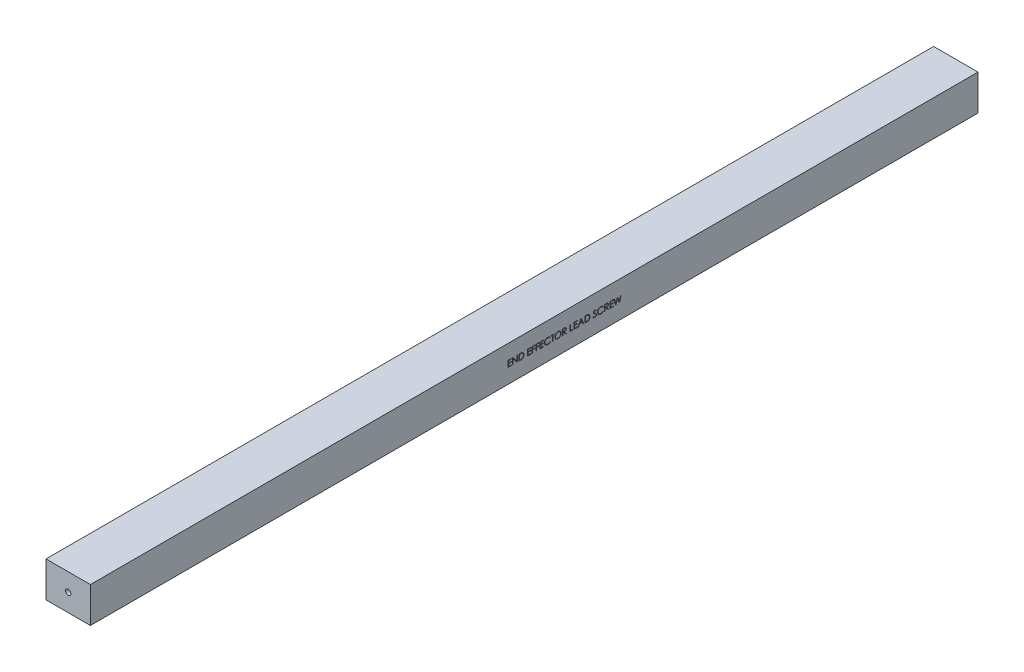
from build123d import *

# Parameters (mm, degrees)
SKETCH1_W           = 25.4
SKETCH1_H           = 20.32
BOSS_EXTRUDE1_DEPTH = 508
CUT_EXTRUDE1_DEPTH  = 2
SKETCH3_R           = 1.5
CUT_EXTRUDE2_DEPTH  = 12.7


with BuildPart() as part:
    # Sketch1 → Boss-Extrude1 (new body)
    with BuildSketch(Plane.XY):
        Rectangle(SKETCH1_W, SKETCH1_H)
    extrude(amount=BOSS_EXTRUDE1_DEPTH)

    # Sketch2 → Cut-Extrude1 (cut)
    # profile 1 of 20: a face of its own
    with BuildSketch(Plane(origin=(12.7, 0, 0), x_dir=(0, 0, -1), z_dir=(1, 0, 0))):
        Polygon((-268.940166523, 1.755607932), (-266.965807548, 1.755607932), (-266.965807548, 1.396633573), (-268.626063959, 1.396633573), (-268.626063959, 0.319710496), (-266.965807548, 0.319710496), (-266.965807548, -0.039263863), (-268.626063959, -0.039263863), (-268.626063959, -1.385417709), (-266.965807548, -1.385417709), (-266.965807548, -1.744392068), (-268.940166523, -1.744392068), align=None)
    # profile 2 of 20: a face of its own
    with BuildSketch(Plane(origin=(12.7, 0, 0), x_dir=(0, 0, -1), z_dir=(1, 0, 0))):
        Polygon((-266.33760242, -1.744392068), (-266.33760242, 1.755607932), (-266.271696971, 1.755607932), (-263.959397292, -0.9990996), (-263.959397292, 1.755607932), (-263.645294728, 1.755607932), (-263.645294728, -1.744392068), (-263.716809151, -1.744392068), (-266.023499856, 1.004005368), (-266.023499856, -1.744392068), align=None)
    # profile 3 of 20: a face of its own
    with BuildSketch(Plane(origin=(12.7, 0, 0), x_dir=(0, 0, -1), z_dir=(1, 0, 0))):
        with BuildLine():
            Line((-262.74785883, -1.744392068), (-262.74785883, 1.755607932))
            Line((-262.74785883, 1.755607932), (-262.041128061, 1.755607932))
            add(Edge.make_bspline(
                [(-262.041128061, 1.755607932), (-261.979659073, 1.755165362), (-261.860901308, 1.754310319), (-261.68928886, 1.748888928), (-261.530505098, 1.739298462), (-261.385072239, 1.725328936), (-261.252591027, 1.708175902), (-261.133432418, 1.686675498), (-261.026980276, 1.661287328), (-260.961510835, 1.639641877), (-260.930551138, 1.629406009)],
                knots=[0, 0, 0, 0, 1.314313732, 2.53924729, 3.670748893, 4.714932338, 5.66265055, 6.526160246, 7.303039223, 8, 8, 8, 8], degree=3))
            add(Edge.make_bspline(
                [(-260.930551138, 1.629406009), (-260.890056399, 1.613975303), (-260.809985206, 1.583463809), (-260.695978084, 1.525907508), (-260.588652721, 1.460694406), (-260.487433576, 1.387738543), (-260.39463275, 1.304974195), (-260.306624853, 1.215917109), (-260.227010129, 1.117328769), (-260.154101833, 1.011253781), (-260.088366174, 0.898941729), (-260.031227016, 0.78060662), (-259.983773022, 0.656849412), (-259.944379796, 0.528014264), (-259.913333338, 0.393817886), (-259.892151407, 0.25410402), (-259.878180417, 0.109424831), (-259.876776365, 0.011250367), (-259.876063959, -0.038562741)],
                knots=[0, 0, 0, 0, 0.984719456, 1.947108742, 2.898477687, 3.838006223, 4.779231079, 5.722358779, 6.681677486, 7.655904652, 8.64651281, 9.637519902, 10.640069247, 11.656948941, 12.698408672, 13.768548281, 14.867775369, 16, 16, 16, 16], degree=3))
            add(Edge.make_bspline(
                [(-259.876063959, -0.038562741), (-259.876692926, -0.081823979), (-259.877932372, -0.167074768), (-259.889061688, -0.292715664), (-259.905238008, -0.414629235), (-259.930282206, -0.532234935), (-259.960684719, -0.646563153), (-259.999648871, -0.756395398), (-260.044284367, -0.862739207), (-260.096334245, -0.964156683), (-260.15347563, -1.060240055), (-260.214797374, -1.150815583), (-260.280234069, -1.234590805), (-260.350409702, -1.311819417), (-260.424417418, -1.382384996), (-260.502741749, -1.446877011), (-260.5855848, -1.504033566), (-260.672575522, -1.556100674), (-260.766251652, -1.60152103), (-260.868387518, -1.639951039), (-260.979418696, -1.671797655), (-261.099072653, -1.698368551), (-261.22755613, -1.719445853), (-261.364995096, -1.733572246), (-261.511178386, -1.743125178), (-261.611557651, -1.743961572), (-261.663223414, -1.744392068)],
                knots=[0, 0, 0, 0, 1.105936401, 2.179363191, 3.223086493, 4.248585256, 5.251745608, 6.245858792, 7.225916811, 8.198733463, 9.158002045, 10.082870192, 10.993790845, 11.873723703, 12.748670949, 13.606408763, 14.465103618, 15.319838547, 16.196477973, 17.123216899, 18.106603292, 19.147568657, 20.255746949, 21.433717677, 22.679120308, 24, 24, 24, 24], degree=3))
            Line((-261.663223414, -1.744392068), (-262.74785883, -1.744392068))
        make_face()
        with BuildLine():
            Line((-262.433756266, -1.385417709), (-262.032013478, -1.385417709))
            add(Edge.make_bspline(
                [(-262.032013478, -1.385417709), (-261.974285107, -1.385169613), (-261.863252309, -1.384692432), (-261.703594311, -1.380505229), (-261.557714915, -1.373663292), (-261.425593405, -1.364088214), (-261.307304381, -1.351419599), (-261.202600631, -1.337294696), (-261.111825373, -1.319697245), (-261.056895936, -1.303746286), (-261.031512676, -1.296375241)],
                knots=[0, 0, 0, 0, 1.375205317, 2.645023457, 3.804390687, 4.853969522, 5.800190428, 6.637939096, 7.370582563, 8, 8, 8, 8], degree=3))
            add(Edge.make_bspline(
                [(-261.031512676, -1.296375241), (-260.999564314, -1.285123683), (-260.936430676, -1.26288931), (-260.845549591, -1.222331648), (-260.760792586, -1.174289579), (-260.680682561, -1.120887305), (-260.606355906, -1.060241303), (-260.536931789, -0.993670314), (-260.472549988, -0.920835539), (-260.41387568, -0.841827377), (-260.361367376, -0.757137581), (-260.315896147, -0.667598748), (-260.276044615, -0.574191938), (-260.244766022, -0.475482779), (-260.220250438, -0.372353721), (-260.20288575, -0.264797507), (-260.192071026, -0.152834225), (-260.190809578, -0.076682101), (-260.190166523, -0.037861619)],
                knots=[0, 0, 0, 0, 0.998632004, 1.973411704, 2.929992603, 3.868527914, 4.809262121, 5.754881198, 6.702106254, 7.672490631, 8.653608572, 9.636854334, 10.631411391, 11.644891563, 12.686317036, 13.754757253, 14.855430412, 16, 16, 16, 16], degree=3))
            add(Edge.make_bspline(
                [(-260.190166523, -0.037861619), (-260.19067981, 0.003071861), (-260.191688168, 0.083486045), (-260.204362478, 0.201476741), (-260.222884034, 0.314957391), (-260.24966772, 0.423935587), (-260.283798598, 0.528623939), (-260.32639324, 0.628443449), (-260.375059859, 0.724448318), (-260.432963196, 0.814422684), (-260.49637879, 0.899515793), (-260.566756669, 0.977470708), (-260.642978707, 1.048465009), (-260.724213557, 1.113604321), (-260.812750656, 1.170267997), (-260.906504347, 1.220954678), (-261.006850018, 1.26397057), (-261.076662714, 1.286849432), (-261.112141683, 1.298476522)],
                knots=[0, 0, 0, 0, 1.122418816, 2.205001699, 3.251619955, 4.274784885, 5.280384055, 6.268708349, 7.249350384, 8.229342522, 9.199999885, 10.157847722, 11.105861043, 12.055065948, 13.010012805, 13.98527497, 14.976112212, 16, 16, 16, 16], degree=3))
            add(Edge.make_bspline(
                [(-261.112141683, 1.298476522), (-261.141492829, 1.30659295), (-261.20390142, 1.323850702), (-261.305740884, 1.342676075), (-261.420356033, 1.359280574), (-261.548255734, 1.373338613), (-261.689294193, 1.383425934), (-261.843579881, 1.390997249), (-262.011179486, 1.396103882), (-262.12736202, 1.396452589), (-262.187662516, 1.396633573)],
                knots=[0, 0, 0, 0, 0.674548936, 1.434276114, 2.292660221, 3.240891867, 4.284742987, 5.42552168, 6.663806718, 8, 8, 8, 8], degree=3))
            Line((-262.187662516, 1.396633573), (-262.433756266, 1.396633573))
            Line((-262.433756266, 1.396633573), (-262.433756266, -1.385417709))
        make_face(mode=Mode.SUBTRACT)
    # profile 4 of 20: a face of its own
    with BuildSketch(Plane(origin=(12.7, 0, 0), x_dir=(0, 0, -1), z_dir=(1, 0, 0))):
        Polygon((-257.811961394, 1.755607932), (-255.83760242, 1.755607932), (-255.83760242, 1.396633573), (-257.49785883, 1.396633573), (-257.49785883, 0.319710496), (-255.83760242, 0.319710496), (-255.83760242, -0.039263863), (-257.49785883, -0.039263863), (-257.49785883, -1.385417709), (-255.83760242, -1.385417709), (-255.83760242, -1.744392068), (-257.811961394, -1.744392068), align=None)
    # profile 5 of 20: a face of its own
    with BuildSketch(Plane(origin=(12.7, 0, 0), x_dir=(0, 0, -1), z_dir=(1, 0, 0))):
        Polygon((-255.209397292, 1.755607932), (-253.504269087, 1.755607932), (-253.504269087, 1.396633573), (-254.895294728, 1.396633573), (-254.895294728, 0.319710496), (-253.504269087, 0.319710496), (-253.504269087, -0.039263863), (-254.895294728, -0.039263863), (-254.895294728, -1.744392068), (-255.209397292, -1.744392068), align=None)
    # profile 6 of 20: a face of its own
    with BuildSketch(Plane(origin=(12.7, 0, 0), x_dir=(0, 0, -1), z_dir=(1, 0, 0))):
        Polygon((-252.876063959, 1.755607932), (-251.170935753, 1.755607932), (-251.170935753, 1.396633573), (-252.561961394, 1.396633573), (-252.561961394, 0.319710496), (-251.170935753, 0.319710496), (-251.170935753, -0.039263863), (-252.561961394, -0.039263863), (-252.561961394, -1.744392068), (-252.876063959, -1.744392068), align=None)
    # profile 7 of 20: a face of its own
    with BuildSketch(Plane(origin=(12.7, 0, 0), x_dir=(0, 0, -1), z_dir=(1, 0, 0))):
        Polygon((-250.542730625, 1.755607932), (-248.568371651, 1.755607932), (-248.568371651, 1.396633573), (-250.228628061, 1.396633573), (-250.228628061, 0.319710496), (-248.568371651, 0.319710496), (-248.568371651, -0.039263863), (-250.228628061, -0.039263863), (-250.228628061, -1.385417709), (-248.568371651, -1.385417709), (-248.568371651, -1.744392068), (-250.542730625, -1.744392068), align=None)
    # profile 8 of 20: a face of its own
    with BuildSketch(Plane(origin=(12.7, 0, 0), x_dir=(0, 0, -1), z_dir=(1, 0, 0))):
        with BuildLine():
            Line((-244.709397292, 1.113380368), (-244.984237035, 0.90304383))
            add(Edge.make_bspline(
                [(-244.984237035, 0.90304383), (-245.003842924, 0.926409799), (-245.042790371, 0.972826715), (-245.105449573, 1.03800626), (-245.170751216, 1.099071521), (-245.238670337, 1.156313401), (-245.310429457, 1.207730166), (-245.384290255, 1.256001269), (-245.461488301, 1.299269007), (-245.568240035, 1.351731993), (-245.707887884, 1.406478148), (-245.883682723, 1.45238138), (-246.067193821, 1.481602555), (-246.192391421, 1.484767397), (-246.256071971, 1.486377163)],
                knots=[0, 0, 0, 0, 0.757959112, 1.505699292, 2.245454638, 2.979532153, 3.711538275, 4.438200793, 5.171680507, 5.909471876, 7.393775596, 8.890124382, 10.418191784, 12, 12, 12, 12], degree=3))
            add(Edge.make_bspline(
                [(-246.256071971, 1.486377163), (-246.291155271, 1.4859732), (-246.360996263, 1.485169024), (-246.464644737, 1.474559899), (-246.566357788, 1.459648689), (-246.666069254, 1.437523366), (-246.763652213, 1.409550747), (-246.859744615, 1.376125333), (-246.952955215, 1.334770493), (-247.044573453, 1.289062233), (-247.132352664, 1.237434788), (-247.215407712, 1.181121437), (-247.293435679, 1.12075234), (-247.366498292, 1.056101234), (-247.43467024, 0.987459273), (-247.497457551, 0.914094932), (-247.554642961, 0.836242758), (-247.607359986, 0.754929351), (-247.654572719, 0.670391559), (-247.694102599, 0.582316489), (-247.729107721, 0.492212385), (-247.756806964, 0.399061225), (-247.77873148, 0.303518459), (-247.793859144, 0.205327671), (-247.804347615, 0.104693991), (-247.805147792, 0.036484679), (-247.805551138, 0.002102323)],
                knots=[0, 0, 0, 0, 1.054917814, 2.100044995, 3.131103042, 4.146048494, 5.169673617, 6.183595914, 7.203665975, 8.234915748, 9.262203917, 10.264457458, 11.251630812, 12.227803204, 13.197192746, 14.159520551, 15.12972552, 16.100847026, 17.073214652, 18.039054194, 19.002613845, 19.979014051, 20.95965708, 21.949030935, 22.966165397, 24, 24, 24, 24], degree=3))
            add(Edge.make_bspline(
                [(-247.805551138, 0.002102323), (-247.804289319, -0.049628997), (-247.801811905, -0.151196582), (-247.779763571, -0.299967192), (-247.746258479, -0.442487866), (-247.696042902, -0.577867708), (-247.634123852, -0.707776066), (-247.55588324, -0.83001492), (-247.465266703, -0.946431484), (-247.360992284, -1.054274432), (-247.246586468, -1.152788157), (-247.123838556, -1.239538739), (-246.993054268, -1.311853621), (-246.855677638, -1.372029568), (-246.710651524, -1.418286295), (-246.558236722, -1.450850419), (-246.398764726, -1.4720926), (-246.289795327, -1.474126288), (-246.234337196, -1.475161299)],
                knots=[0, 0, 0, 0, 1.029171465, 2.020641659, 2.987623507, 3.938342917, 4.889210282, 5.84687017, 6.821220943, 7.821438502, 8.827599549, 9.822697543, 10.807740252, 11.797342354, 12.80366471, 13.83203677, 14.896651826, 16, 16, 16, 16], degree=3))
            add(Edge.make_bspline(
                [(-246.234337196, -1.475161299), (-246.173234507, -1.473472519), (-246.052969798, -1.470148596), (-245.876601771, -1.441989347), (-245.707766006, -1.396331429), (-245.546453419, -1.332433507), (-245.393118773, -1.249368219), (-245.247522113, -1.148670342), (-245.109540542, -1.029382009), (-245.02656926, -0.938298881), (-244.984237035, -0.891827965)],
                knots=[0, 0, 0, 0, 1.028121516, 2.023589091, 2.998037872, 3.967518031, 4.937445131, 5.927275754, 6.942489185, 8, 8, 8, 8], degree=3))
            Line((-244.984237035, -0.891827965), (-244.709397292, -1.100061138))
            add(Edge.make_bspline(
                [(-244.709397292, -1.100061138), (-244.731515402, -1.12859959), (-244.775645677, -1.185539797), (-244.847103694, -1.265811506), (-244.922380991, -1.341315542), (-245.002036701, -1.411443163), (-245.085154493, -1.477597629), (-245.173226805, -1.53789946), (-245.265095838, -1.593190344), (-245.360450317, -1.643817269), (-245.45918893, -1.688734516), (-245.561193365, -1.727188284), (-245.66602394, -1.760313173), (-245.773685448, -1.78756511), (-245.884401205, -1.808836194), (-245.997771679, -1.823055869), (-246.114041555, -1.832797783), (-246.192482976, -1.833685699), (-246.23223383, -1.834135658)],
                knots=[0, 0, 0, 0, 0.986787822, 1.968848986, 2.935600012, 3.899624008, 4.868462664, 5.837806735, 6.815139263, 7.798259679, 8.787526145, 9.778297419, 10.776456485, 11.791383307, 12.812564526, 13.85620153, 14.913611965, 16, 16, 16, 16], degree=3))
            add(Edge.make_bspline(
                [(-246.23223383, -1.834135658), (-246.269877497, -1.833873665), (-246.344313188, -1.833355607), (-246.454211939, -1.82496344), (-246.56120152, -1.813513703), (-246.664976146, -1.796273572), (-246.766102121, -1.775929232), (-246.863662705, -1.748657975), (-246.958617916, -1.718108809), (-247.050586256, -1.682203822), (-247.139645956, -1.641687639), (-247.225509768, -1.59589608), (-247.3081382, -1.545214216), (-247.388343621, -1.490759205), (-247.464941204, -1.430781903), (-247.53859473, -1.366115269), (-247.609717206, -1.296977258), (-247.653719891, -1.247122405), (-247.675843606, -1.222056331)],
                knots=[0, 0, 0, 0, 1.114604814, 2.203992996, 3.262667896, 4.300477797, 5.318619304, 6.316056647, 7.298880507, 8.271930387, 9.238335007, 10.195173496, 11.151986948, 12.108099108, 13.064862484, 14.031167946, 15.010108607, 16, 16, 16, 16], degree=3))
            add(Edge.make_bspline(
                [(-247.675843606, -1.222056331), (-247.711279249, -1.178515142), (-247.781722726, -1.091958431), (-247.87184841, -0.95167245), (-247.948995965, -0.805204241), (-248.011371886, -0.651784313), (-248.060134619, -0.491756925), (-248.093915814, -0.325041411), (-248.115867419, -0.151793469), (-248.118377707, -0.03395668), (-248.119653702, 0.025940464)],
                knots=[0, 0, 0, 0, 0.994628077, 1.977248131, 2.950237994, 3.925870899, 4.908910175, 5.911660606, 6.938484602, 8, 8, 8, 8], degree=3))
            add(Edge.make_bspline(
                [(-248.119653702, 0.025940464), (-248.118098509, 0.088895918), (-248.115038762, 0.212756842), (-248.089042967, 0.394530796), (-248.047224171, 0.568682194), (-247.987827282, 0.734885939), (-247.912521931, 0.894016219), (-247.819495317, 1.044857424), (-247.709828175, 1.188374224), (-247.584380607, 1.322388975), (-247.446813272, 1.444928328), (-247.299494458, 1.552734531), (-247.142712511, 1.642452047), (-246.978194659, 1.71744821), (-246.804708978, 1.775092673), (-246.622625609, 1.81544586), (-246.432286694, 1.840562976), (-246.302424268, 1.843738184), (-246.236440561, 1.845351522)],
                knots=[0, 0, 0, 0, 1.032925535, 2.032216505, 3.007276963, 3.968222605, 4.92396291, 5.891752235, 6.871517503, 7.883894988, 8.900124299, 9.891468569, 10.874487609, 11.85992873, 12.854644235, 13.869047385, 14.917252991, 16, 16, 16, 16], degree=3))
            add(Edge.make_bspline(
                [(-246.236440561, 1.845351522), (-246.196226089, 1.844869384), (-246.116625592, 1.84391504), (-245.998872939, 1.834608898), (-245.884230613, 1.819095291), (-245.77261963, 1.797979221), (-245.663497014, 1.7717719), (-245.557696773, 1.737631602), (-245.454598087, 1.69859507), (-245.354851178, 1.653636604), (-245.258934628, 1.603169863), (-245.16687831, 1.547754239), (-245.079413451, 1.487458434), (-244.995924603, 1.422795259), (-244.917808391, 1.352396699), (-244.842846913, 1.278199103), (-244.773585835, 1.198065279), (-244.73083264, 1.141660345), (-244.709397292, 1.113380368)],
                knots=[0, 0, 0, 0, 1.096760587, 2.17092713, 3.219439832, 4.250915756, 5.268269357, 6.278326846, 7.281116186, 8.274029601, 9.260640565, 10.235837813, 11.203064059, 12.156899882, 13.114053108, 14.069676657, 15.032185724, 16, 16, 16, 16], degree=3))
        make_face()
    # profile 9 of 20: a face of its own
    with BuildSketch(Plane(origin=(12.7, 0, 0), x_dir=(0, 0, -1), z_dir=(1, 0, 0))):
        Polygon((-244.395294728, 1.396633573), (-244.395294728, 1.755607932), (-242.555551138, 1.755607932), (-242.555551138, 1.396633573), (-243.318371651, 1.396633573), (-243.318371651, -1.744392068), (-243.632474215, -1.744392068), (-243.632474215, 1.396633573), align=None)
    # profile 10 of 20: a face of its own
    with BuildSketch(Plane(origin=(12.7, 0, 0), x_dir=(0, 0, -1), z_dir=(1, 0, 0))):
        with BuildLine():
            add(Edge.make_bspline(
                [(-240.379269087, 1.845351522), (-240.314460981, 1.843710042), (-240.187172514, 1.840486042), (-240.000097616, 1.815806938), (-239.821502521, 1.773111548), (-239.649932382, 1.716248566), (-239.487439406, 1.64039418), (-239.332800513, 1.548709032), (-239.186383639, 1.440232573), (-239.050162258, 1.315803346), (-238.925505307, 1.180419892), (-238.815679421, 1.035941982), (-238.723637127, 0.88324318), (-238.64805134, 0.722782349), (-238.588752731, 0.554922381), (-238.547833687, 0.378768379), (-238.521695537, 0.195461688), (-238.518639759, 0.070434824), (-238.5170896, 0.007010176)],
                knots=[0, 0, 0, 0, 1.065120563, 2.091984664, 3.0946048, 4.079830382, 5.057816894, 6.036188127, 7.030412546, 8.04752943, 9.064399622, 10.05169764, 11.02544977, 11.989514704, 12.962713494, 13.945757189, 14.957906945, 16, 16, 16, 16], degree=3))
            add(Edge.make_bspline(
                [(-238.5170896, 0.007010176), (-238.518639532, -0.055947271), (-238.521694629, -0.180043691), (-238.547863406, -0.362187135), (-238.588904406, -0.537277832), (-238.647500672, -0.705023485), (-238.722726151, -0.865601048), (-238.815381322, -1.018588002), (-238.924522533, -1.164034501), (-239.048729384, -1.300347166), (-239.184130426, -1.425344637), (-239.329360693, -1.534263512), (-239.481154012, -1.627987637), (-239.641463721, -1.702771311), (-239.808163757, -1.762543231), (-239.982746081, -1.803295861), (-240.164392635, -1.829582904), (-240.288263638, -1.83260142), (-240.351224215, -1.834135658)],
                knots=[0, 0, 0, 0, 1.043624062, 2.057103931, 3.04512605, 4.022047818, 4.998200453, 5.980619268, 6.982898556, 8.009068085, 9.034988726, 10.034168286, 11.015286542, 11.987931943, 12.962482838, 13.94673481, 14.956375938, 16, 16, 16, 16], degree=3))
            add(Edge.make_bspline(
                [(-240.351224215, -1.834135658), (-240.414648534, -1.832586271), (-240.53967475, -1.829532017), (-240.723211785, -1.803350612), (-240.899489529, -1.762409308), (-241.06800388, -1.703899872), (-241.22884881, -1.628282641), (-241.382338893, -1.536078262), (-241.52785804, -1.426671121), (-241.664199786, -1.302504547), (-241.788948985, -1.167332994), (-241.89770836, -1.022498739), (-241.989933474, -0.870843283), (-242.065296806, -0.711945759), (-242.124961265, -0.546574316), (-242.165666084, -0.373625838), (-242.192002036, -0.194086333), (-242.195036882, -0.071843434), (-242.196576779, -0.009816747)],
                knots=[0, 0, 0, 0, 1.053102029, 2.075944431, 3.073151272, 4.055350789, 5.033113405, 6.020478099, 7.024410459, 8.052272461, 9.079885166, 10.07527673, 11.055994387, 12.023226415, 12.992069828, 13.970394897, 14.97016774, 16, 16, 16, 16], degree=3))
            add(Edge.make_bspline(
                [(-242.196576779, -0.009816747), (-242.196042144, 0.031815922), (-242.194979617, 0.114556045), (-242.182187925, 0.237422645), (-242.163626224, 0.358313303), (-242.137024311, 0.476884251), (-242.102232644, 0.592845236), (-242.061180617, 0.706995999), (-242.011040771, 0.818179722), (-241.954360123, 0.926923114), (-241.891098315, 1.03153102), (-241.821222566, 1.130410603), (-241.747187197, 1.2243916), (-241.666023804, 1.311038604), (-241.580407358, 1.39287226), (-241.48894898, 1.468634977), (-241.392206736, 1.539009928), (-241.289764356, 1.602430269), (-241.184146081, 1.659789404), (-241.075269304, 1.709011255), (-240.964612732, 1.751257316), (-240.851658084, 1.785498141), (-240.736705312, 1.812530177), (-240.619503527, 1.830937531), (-240.500146101, 1.843761849), (-240.419734782, 1.844819351), (-240.379269087, 1.845351522)],
                knots=[0, 0, 0, 0, 1.037015668, 2.060948919, 3.074880161, 4.083647147, 5.086022904, 6.090072063, 7.104153813, 8.122640571, 9.144368836, 10.147691507, 11.138137339, 12.123020368, 13.103399296, 14.087645067, 15.080126199, 16.082011238, 17.087798457, 18.072939717, 19.057185487, 20.037253025, 21.01195951, 21.997135196, 22.992090687, 24, 24, 24, 24], degree=3))
        make_face()
        with BuildLine():
            add(Edge.make_bspline(
                [(-240.363844407, 1.486377163), (-240.397059041, 1.485972273), (-240.463170774, 1.485166363), (-240.56145531, 1.474550647), (-240.658447244, 1.459420758), (-240.754166606, 1.437839238), (-240.848212895, 1.408435185), (-240.941462737, 1.374594277), (-241.03306579, 1.333373186), (-241.122719648, 1.286800482), (-241.209634723, 1.235251561), (-241.291647425, 1.178279794), (-241.368970069, 1.11722124), (-241.441413335, 1.051933402), (-241.508764508, 0.9820838), (-241.572349209, 0.908731364), (-241.629618791, 0.829779473), (-241.682104368, 0.747369066), (-241.729072208, 0.661607485), (-241.770837563, 0.573397623), (-241.805001571, 0.482019936), (-241.832863948, 0.388465779), (-241.855963759, 0.292883319), (-241.870597683, 0.19454747), (-241.881330042, 0.093952358), (-241.882089888, 0.025970504), (-241.882474215, -0.008414504)],
                knots=[0, 0, 0, 0, 1.008559885, 2.007477868, 2.99961109, 3.989939068, 4.984837346, 5.991145699, 7.001802488, 8.033829008, 9.059044045, 10.069351652, 11.065060232, 12.050310815, 13.029377138, 14.011219647, 14.996725999, 15.989392538, 16.977580475, 17.965360261, 18.951710183, 19.937753436, 20.929683414, 21.935841486, 22.955955122, 24, 24, 24, 24], degree=3))
            add(Edge.make_bspline(
                [(-241.882474215, -0.008414504), (-241.881199353, -0.058976725), (-241.878691305, -0.158448255), (-241.856733735, -0.304216399), (-241.822911761, -0.444304685), (-241.773054394, -0.577946594), (-241.710703779, -0.706290877), (-241.633676889, -0.828198982), (-241.542417804, -0.943703856), (-241.438754277, -1.051999125), (-241.32543157, -1.150844929), (-241.205098841, -1.237608338), (-241.079045233, -1.311018588), (-240.94694203, -1.37082366), (-240.809494491, -1.418213398), (-240.66581694, -1.450692029), (-240.516866481, -1.472067485), (-240.415335825, -1.474120241), (-240.363844407, -1.475161299)],
                knots=[0, 0, 0, 0, 1.032063989, 2.030389145, 3.003944642, 3.970395727, 4.937377036, 5.913328081, 6.909231446, 7.93887556, 8.970685674, 9.976071282, 10.964166581, 11.944589148, 12.933237628, 13.927779006, 14.949070134, 16, 16, 16, 16], degree=3))
            add(Edge.make_bspline(
                [(-240.363844407, -1.475161299), (-240.329234906, -1.474685794), (-240.260593869, -1.473742726), (-240.158498347, -1.46424405), (-240.058242135, -1.44901218), (-239.959965855, -1.427081524), (-239.863781044, -1.399634318), (-239.769286241, -1.36702659), (-239.67748795, -1.326345386), (-239.587228113, -1.281397435), (-239.500831871, -1.230157277), (-239.418356339, -1.175119128), (-239.341880359, -1.114150507), (-239.269491287, -1.049832694), (-239.201863598, -0.980868847), (-239.139454614, -0.907348625), (-239.082474482, -0.828807967), (-239.030008835, -0.746522562), (-238.983205573, -0.660526309), (-238.942426474, -0.571996631), (-238.907830358, -0.481151522), (-238.879901853, -0.38785995), (-238.858016391, -0.292299101), (-238.842936471, -0.194341023), (-238.832388033, -0.094181681), (-238.831592956, -0.026437825), (-238.831192164, 0.007711297)],
                knots=[0, 0, 0, 0, 1.047197238, 2.076906641, 3.100256066, 4.114471768, 5.12198147, 6.126382909, 7.136867548, 8.15857795, 9.17633901, 10.174870724, 11.156907918, 12.133735059, 13.104061851, 14.077631395, 15.04955518, 16.038496417, 17.029181396, 18.010275684, 18.986308667, 19.968651475, 20.955262928, 21.950658345, 22.966943676, 24, 24, 24, 24], degree=3))
            add(Edge.make_bspline(
                [(-238.831192164, 0.007711297), (-238.831593277, 0.041626802), (-238.832388958, 0.108904452), (-238.842931433, 0.20836527), (-238.858032323, 0.305618482), (-238.879795031, 0.400282285), (-238.907845185, 0.49238081), (-238.942432515, 0.581827558), (-238.983217815, 0.668955753), (-239.030026039, 0.75355005), (-239.082641863, 0.834724788), (-239.140136106, 0.9123272), (-239.203501454, 0.984899941), (-239.270927479, 1.054234635), (-239.344098364, 1.118852525), (-239.422682658, 1.178775046), (-239.505726336, 1.23544832), (-239.593653572, 1.286573882), (-239.684397525, 1.333788115), (-239.777511483, 1.374239118), (-239.871940583, 1.408611237), (-239.967444695, 1.437928202), (-240.064827674, 1.459336232), (-240.163431502, 1.474564282), (-240.263119761, 1.485162668), (-240.330162981, 1.485971047), (-240.363844407, 1.486377163)],
                knots=[0, 0, 0, 0, 1.02996197, 2.043119294, 3.035359645, 4.018872909, 4.991431989, 5.957985074, 6.929999688, 7.912076566, 8.892894881, 9.867085534, 10.843653904, 11.817741046, 12.803660682, 13.806313499, 14.818574707, 15.856120519, 16.894564902, 17.924820532, 18.937903209, 19.946497019, 20.957711757, 21.963978472, 22.977135795, 24, 24, 24, 24], degree=3))
        make_face(mode=Mode.SUBTRACT)
    # profile 11 of 20: a face of its own
    with BuildSketch(Plane(origin=(12.7, 0, 0), x_dir=(0, 0, -1), z_dir=(1, 0, 0))):
        with BuildLine():
            Line((-237.799140882, 1.755607932), (-237.098720209, 1.755607932))
            add(Edge.make_bspline(
                [(-237.098720209, 1.755607932), (-237.05197908, 1.755452346), (-236.962230936, 1.755153604), (-236.833657665, 1.753487841), (-236.716830568, 1.748713485), (-236.611810729, 1.744604902), (-236.518600074, 1.73711296), (-236.436912783, 1.729952313), (-236.367125086, 1.720578652), (-236.324879234, 1.711873229), (-236.305751459, 1.70793165)],
                knots=[0, 0, 0, 0, 1.410062039, 2.707475311, 3.878576406, 4.937260626, 5.877586885, 6.699081471, 7.410979367, 8, 8, 8, 8], degree=3))
            add(Edge.make_bspline(
                [(-236.305751459, 1.70793165), (-236.280144834, 1.701604885), (-236.229477845, 1.689086321), (-236.156527779, 1.66262672), (-236.087013455, 1.632007096), (-236.021223631, 1.596043375), (-235.959487839, 1.554468596), (-235.901169529, 1.508000473), (-235.846004065, 1.456893267), (-235.796222435, 1.399858426), (-235.749283383, 1.340021916), (-235.709694757, 1.275318159), (-235.675568277, 1.207656632), (-235.64839776, 1.136349214), (-235.626519787, 1.062087442), (-235.611093547, 0.984198645), (-235.60184236, 0.90303767), (-235.600900504, 0.847679762), (-235.600422933, 0.819610336)],
                knots=[0, 0, 0, 0, 1.027469482, 2.033020251, 3.019912614, 3.986113645, 4.951240523, 5.91722682, 6.890402269, 7.87763091, 8.8651537, 9.85103654, 10.82876324, 11.815024772, 12.821070561, 13.842952187, 14.906261191, 16, 16, 16, 16], degree=3))
            add(Edge.make_bspline(
                [(-235.600422933, 0.819610336), (-235.601891931, 0.772975231), (-235.604758327, 0.681978063), (-235.63148343, 0.549917182), (-235.67525995, 0.426727867), (-235.735583239, 0.312565229), (-235.812402715, 0.209654584), (-235.904727506, 0.119264129), (-236.012609118, 0.043624216), (-236.113038433, -0.008828588), (-236.201752633, -0.042421497), (-236.274785946, -0.066057856), (-236.354452923, -0.084319821), (-236.439990258, -0.100679953), (-236.531753914, -0.113031647), (-236.629523953, -0.122078242), (-236.733370105, -0.127732291), (-236.804709174, -0.128574295), (-236.84140851, -0.129007453)],
                knots=[0, 0, 0, 0, 1.260483769, 2.459530307, 3.627416485, 4.787058657, 5.939039949, 7.08810263, 8.267026773, 9.491475466, 10.141966685, 10.831826277, 11.566392101, 12.351337768, 13.187381173, 14.07005841, 15.007169909, 16, 16, 16, 16], degree=3))
            Line((-236.84140851, -0.129007453), (-235.555551138, -1.744392068))
            Line((-235.555551138, -1.744392068), (-235.943972612, -1.744392068))
            Line((-235.943972612, -1.744392068), (-237.229829984, -0.129007453))
            Line((-237.229829984, -0.129007453), (-237.485038318, -0.129007453))
            Line((-237.485038318, -0.129007453), (-237.485038318, -1.744392068))
            Line((-237.485038318, -1.744392068), (-237.799140882, -1.744392068))
            Line((-237.799140882, -1.744392068), (-237.799140882, 1.755607932))
        make_face()
        with BuildLine():
            Line((-237.485038318, 1.396633573), (-237.485038318, 0.229966906))
            Line((-237.485038318, 0.229966906), (-236.844212997, 0.225059054))
            add(Edge.make_bspline(
                [(-236.844212997, 0.225059054), (-236.814292958, 0.225045817), (-236.756299401, 0.225020161), (-236.672398736, 0.229013937), (-236.594278624, 0.233557255), (-236.522237872, 0.240506601), (-236.456244297, 0.249462673), (-236.396330884, 0.260665657), (-236.342399832, 0.273717719), (-236.279501293, 0.293919345), (-236.209264762, 0.325925364), (-236.132933302, 0.372490862), (-236.067930964, 0.431059981), (-236.013013102, 0.498033437), (-235.968883671, 0.571669686), (-235.937771616, 0.651086055), (-235.918029174, 0.734277653), (-235.915700629, 0.791455761), (-235.914525497, 0.820311458)],
                knots=[0, 0, 0, 0, 1.146690395, 2.22261258, 3.21895312, 4.145990853, 4.996080663, 5.770904154, 6.481378293, 7.121626537, 8.300444488, 9.431385265, 10.535395872, 11.636531494, 12.74115979, 13.810798291, 14.895190096, 16, 16, 16, 16], degree=3))
            add(Edge.make_bspline(
                [(-235.914525497, 0.820311458), (-235.915727618, 0.848458031), (-235.918109783, 0.90423427), (-235.937558552, 0.98589018), (-235.970447933, 1.062957131), (-236.014770171, 1.135121616), (-236.068769326, 1.200627351), (-236.132087139, 1.256674504), (-236.202992334, 1.302923969), (-236.269263532, 1.33247835), (-236.328497745, 1.350598203), (-236.379927405, 1.363349367), (-236.438038883, 1.373593836), (-236.503114341, 1.381801896), (-236.574875972, 1.388856841), (-236.653686623, 1.393608619), (-236.739023403, 1.396422484), (-236.798170335, 1.396561572), (-236.828788318, 1.396633573)],
                knots=[0, 0, 0, 0, 1.101028733, 2.181837193, 3.264309656, 4.369019818, 5.486613113, 6.575447106, 7.666700264, 8.788928104, 9.402425223, 10.0903467, 10.862060571, 11.710948788, 12.657782767, 13.684531032, 14.801375019, 16, 16, 16, 16], degree=3))
            Line((-236.828788318, 1.396633573), (-237.485038318, 1.396633573))
        make_face(mode=Mode.SUBTRACT)
    # profile 12 of 20: a face of its own
    with BuildSketch(Plane(origin=(12.7, 0, 0), x_dir=(0, 0, -1), z_dir=(1, 0, 0))):
        Polygon((-233.491448574, 1.755607932), (-233.17734601, 1.755607932), (-233.17734601, -1.385417709), (-231.831192164, -1.385417709), (-231.831192164, -1.744392068), (-233.491448574, -1.744392068), align=None)
    # profile 13 of 20: a face of its own
    with BuildSketch(Plane(origin=(12.7, 0, 0), x_dir=(0, 0, -1), z_dir=(1, 0, 0))):
        Polygon((-231.24785883, 1.755607932), (-229.273499856, 1.755607932), (-229.273499856, 1.396633573), (-230.933756266, 1.396633573), (-230.933756266, 0.319710496), (-229.273499856, 0.319710496), (-229.273499856, -0.039263863), (-230.933756266, -0.039263863), (-230.933756266, -1.385417709), (-229.273499856, -1.385417709), (-229.273499856, -1.744392068), (-231.24785883, -1.744392068), align=None)
    # profile 14 of 20: a face of its own
    with BuildSketch(Plane(origin=(12.7, 0, 0), x_dir=(0, 0, -1), z_dir=(1, 0, 0))):
        Polygon((-227.209397292, 1.755607932), (-225.594012676, -1.744392068), (-225.935458991, -1.744392068), (-226.452886875, -0.622597196), (-228.039525497, -0.622597196), (-228.570975818, -1.744392068), (-228.914525497, -1.744392068), (-227.254269087, 1.755607932), align=None)
        Polygon((-227.235338798, 1.072715304), (-227.868451779, -0.263622837), (-226.618351619, -0.263622837), align=None, mode=Mode.SUBTRACT)
    # profile 15 of 20: a face of its own
    with BuildSketch(Plane(origin=(12.7, 0, 0), x_dir=(0, 0, -1), z_dir=(1, 0, 0))):
        with BuildLine():
            Line((-224.965807548, -1.744392068), (-224.965807548, 1.755607932))
            Line((-224.965807548, 1.755607932), (-224.259076779, 1.755607932))
            add(Edge.make_bspline(
                [(-224.259076779, 1.755607932), (-224.197607791, 1.755165362), (-224.078850026, 1.754310319), (-223.907237578, 1.748888928), (-223.748453816, 1.739298462), (-223.603020957, 1.725328936), (-223.470539745, 1.708175902), (-223.351381136, 1.686675498), (-223.244928994, 1.661287328), (-223.179459553, 1.639641877), (-223.148499856, 1.629406009)],
                knots=[0, 0, 0, 0, 1.314313732, 2.53924729, 3.670748893, 4.714932338, 5.66265055, 6.526160246, 7.303039223, 8, 8, 8, 8], degree=3))
            add(Edge.make_bspline(
                [(-223.148499856, 1.629406009), (-223.108005117, 1.613975303), (-223.027933924, 1.583463809), (-222.913926802, 1.525907508), (-222.806601439, 1.460694406), (-222.705382294, 1.387738543), (-222.612581468, 1.304974195), (-222.524573571, 1.215917109), (-222.444958847, 1.117328769), (-222.372050551, 1.011253781), (-222.306314892, 0.898941729), (-222.249175734, 0.78060662), (-222.20172174, 0.656849412), (-222.162328514, 0.528014264), (-222.131282056, 0.393817886), (-222.110100125, 0.25410402), (-222.096129135, 0.109424831), (-222.094725083, 0.011250367), (-222.094012676, -0.038562741)],
                knots=[0, 0, 0, 0, 0.984719456, 1.947108742, 2.898477687, 3.838006223, 4.779231079, 5.722358779, 6.681677486, 7.655904652, 8.64651281, 9.637519902, 10.640069247, 11.656948941, 12.698408672, 13.768548281, 14.867775369, 16, 16, 16, 16], degree=3))
            add(Edge.make_bspline(
                [(-222.094012676, -0.038562741), (-222.094641644, -0.081823979), (-222.09588109, -0.167074768), (-222.107010406, -0.292715664), (-222.123186726, -0.414629235), (-222.148230924, -0.532234935), (-222.178633437, -0.646563153), (-222.217597589, -0.756395398), (-222.262233085, -0.862739207), (-222.314282963, -0.964156683), (-222.371424348, -1.060240055), (-222.432746092, -1.150815583), (-222.498182787, -1.234590805), (-222.56835842, -1.311819417), (-222.642366136, -1.382384996), (-222.720690467, -1.446877011), (-222.803533518, -1.504033566), (-222.89052424, -1.556100674), (-222.98420037, -1.60152103), (-223.086336236, -1.639951039), (-223.197367414, -1.671797655), (-223.317021371, -1.698368551), (-223.445504848, -1.719445853), (-223.582943814, -1.733572246), (-223.729127104, -1.743125178), (-223.829506369, -1.743961572), (-223.881172132, -1.744392068)],
                knots=[0, 0, 0, 0, 1.105936401, 2.179363191, 3.223086493, 4.248585256, 5.251745608, 6.245858792, 7.225916811, 8.198733463, 9.158002045, 10.082870192, 10.993790845, 11.873723703, 12.748670949, 13.606408763, 14.465103618, 15.319838547, 16.196477973, 17.123216899, 18.106603292, 19.147568657, 20.255746949, 21.433717677, 22.679120308, 24, 24, 24, 24], degree=3))
            Line((-223.881172132, -1.744392068), (-224.965807548, -1.744392068))
        make_face()
        with BuildLine():
            Line((-224.651704984, -1.385417709), (-224.249962196, -1.385417709))
            add(Edge.make_bspline(
                [(-224.249962196, -1.385417709), (-224.192233825, -1.385169613), (-224.081201027, -1.384692432), (-223.921543029, -1.380505229), (-223.775663633, -1.373663292), (-223.643542123, -1.364088214), (-223.525253099, -1.351419599), (-223.420549349, -1.337294696), (-223.329774091, -1.319697245), (-223.274844654, -1.303746286), (-223.249461394, -1.296375241)],
                knots=[0, 0, 0, 0, 1.375205317, 2.645023457, 3.804390687, 4.853969522, 5.800190428, 6.637939096, 7.370582563, 8, 8, 8, 8], degree=3))
            add(Edge.make_bspline(
                [(-223.249461394, -1.296375241), (-223.217513032, -1.285123683), (-223.154379394, -1.26288931), (-223.063498309, -1.222331648), (-222.978741304, -1.174289579), (-222.898631279, -1.120887305), (-222.824304624, -1.060241303), (-222.754880507, -0.993670314), (-222.690498706, -0.920835539), (-222.631824398, -0.841827377), (-222.579316094, -0.757137581), (-222.533844865, -0.667598748), (-222.493993333, -0.574191938), (-222.46271474, -0.475482779), (-222.438199156, -0.372353721), (-222.420834468, -0.264797507), (-222.410019744, -0.152834225), (-222.408758296, -0.076682101), (-222.408115241, -0.037861619)],
                knots=[0, 0, 0, 0, 0.998632004, 1.973411704, 2.929992603, 3.868527914, 4.809262121, 5.754881198, 6.702106254, 7.672490631, 8.653608572, 9.636854334, 10.631411391, 11.644891563, 12.686317036, 13.754757253, 14.855430412, 16, 16, 16, 16], degree=3))
            add(Edge.make_bspline(
                [(-222.408115241, -0.037861619), (-222.408628528, 0.003071861), (-222.409636886, 0.083486045), (-222.422311196, 0.201476741), (-222.440832751, 0.314957391), (-222.467616437, 0.423935587), (-222.501747316, 0.528623939), (-222.544341958, 0.628443449), (-222.593008577, 0.724448318), (-222.650911914, 0.814422684), (-222.714327508, 0.899515793), (-222.784705387, 0.977470708), (-222.860927425, 1.048465009), (-222.942162275, 1.113604321), (-223.030699374, 1.170267997), (-223.124453065, 1.220954678), (-223.224798736, 1.26397057), (-223.294611432, 1.286849432), (-223.330090401, 1.298476522)],
                knots=[0, 0, 0, 0, 1.122418816, 2.205001699, 3.251619955, 4.274784885, 5.280384055, 6.268708349, 7.249350384, 8.229342522, 9.199999885, 10.157847722, 11.105861043, 12.055065948, 13.010012805, 13.98527497, 14.976112212, 16, 16, 16, 16], degree=3))
            add(Edge.make_bspline(
                [(-223.330090401, 1.298476522), (-223.359441547, 1.30659295), (-223.421850138, 1.323850702), (-223.523689602, 1.342676075), (-223.638304751, 1.359280574), (-223.766204452, 1.373338613), (-223.907242911, 1.383425934), (-224.061528599, 1.390997249), (-224.229128204, 1.396103882), (-224.345310738, 1.396452589), (-224.405611234, 1.396633573)],
                knots=[0, 0, 0, 0, 0.674548936, 1.434276114, 2.292660221, 3.240891867, 4.284742987, 5.42552168, 6.663806718, 8, 8, 8, 8], degree=3))
            Line((-224.405611234, 1.396633573), (-224.651704984, 1.396633573))
            Line((-224.651704984, 1.396633573), (-224.651704984, -1.385417709))
        make_face(mode=Mode.SUBTRACT)
    # profile 16 of 20: a face of its own
    with BuildSketch(Plane(origin=(12.7, 0, 0), x_dir=(0, 0, -1), z_dir=(1, 0, 0))):
        with BuildLine():
            Line((-220.388884471, -1.069211779), (-220.093011074, -0.891827965))
            add(Edge.make_bspline(
                [(-220.093011074, -0.891827965), (-220.065492837, -0.93789235), (-220.012768956, -1.026149934), (-219.924817597, -1.145407975), (-219.833684686, -1.246770131), (-219.738695352, -1.329646739), (-219.640429404, -1.394895626), (-219.53824535, -1.441097857), (-219.43248754, -1.469913833), (-219.360513718, -1.473413919), (-219.324581587, -1.475161299)],
                knots=[0, 0, 0, 0, 1.272034388, 2.437168799, 3.508375237, 4.49857839, 5.41946034, 6.295179144, 7.148887113, 8, 8, 8, 8], degree=3))
            add(Edge.make_bspline(
                [(-219.324581587, -1.475161299), (-219.293894726, -1.474306626), (-219.233057953, -1.472612236), (-219.14349571, -1.456331434), (-219.056513908, -1.431319305), (-218.97390527, -1.395498373), (-218.896809656, -1.352159888), (-218.82920296, -1.29981371), (-218.770756847, -1.241207505), (-218.722947733, -1.17582485), (-218.686267697, -1.105507701), (-218.658075629, -1.03333175), (-218.642430555, -0.958163182), (-218.640073802, -0.907552719), (-218.638884471, -0.88201226)],
                knots=[0, 0, 0, 0, 1.095163259, 2.171163733, 3.241058638, 4.321873601, 5.38011039, 6.391990106, 7.366004449, 8.327778327, 9.272591725, 10.192022065, 11.087607919, 12, 12, 12, 12], degree=3))
            add(Edge.make_bspline(
                [(-218.638884471, -0.88201226), (-218.640358782, -0.852871411), (-218.64335584, -0.793632321), (-218.66868732, -0.706232668), (-218.708536567, -0.619740098), (-218.745299211, -0.566238833), (-218.764385273, -0.538462581)],
                knots=[0, 0, 0, 0, 0.938893495, 1.908633276, 2.914225137, 4, 4, 4, 4], degree=3))
            add(Edge.make_bspline(
                [(-218.764385273, -0.538462581), (-218.780055887, -0.518415757), (-218.812954381, -0.476329959), (-218.869511894, -0.413684723), (-218.935878008, -0.349066304), (-219.009781563, -0.280007247), (-219.093914652, -0.209719451), (-219.185642166, -0.134851173), (-219.287306025, -0.058249596), (-219.358605522, -0.00687703), (-219.395394888, 0.019630368)],
                knots=[0, 0, 0, 0, 0.722233717, 1.516239348, 2.393582979, 3.351407094, 4.387010283, 5.505090956, 6.712668013, 8, 8, 8, 8], degree=3))
            add(Edge.make_bspline(
                [(-219.395394888, 0.019630368), (-219.432218884, 0.045858956), (-219.502623561, 0.096006018), (-219.601082143, 0.170430302), (-219.689126606, 0.238474171), (-219.766365623, 0.300778183), (-219.83276522, 0.357350788), (-219.888848631, 0.407648727), (-219.933187188, 0.453032288), (-219.957842768, 0.48247363), (-219.968912516, 0.495692067)],
                knots=[0, 0, 0, 0, 1.452282411, 2.77665338, 3.964542531, 5.026858415, 5.96415736, 6.766646006, 7.446254459, 8, 8, 8, 8], degree=3))
            add(Edge.make_bspline(
                [(-219.968912516, 0.495692067), (-219.984385061, 0.516293104), (-220.014813898, 0.556807807), (-220.054979904, 0.620132665), (-220.089119066, 0.68495593), (-220.115881399, 0.751451795), (-220.138417617, 0.818686724), (-220.153575548, 0.88753797), (-220.163066945, 0.957696588), (-220.164038932, 1.004910089), (-220.164525497, 1.028544631)],
                knots=[0, 0, 0, 0, 1.068054152, 2.10047183, 3.106115577, 4.101338837, 5.06977816, 6.043150881, 7.020423561, 8, 8, 8, 8], degree=3))
            add(Edge.make_bspline(
                [(-220.164525497, 1.028544631), (-220.163220288, 1.065574405), (-220.160637768, 1.138842469), (-220.138797251, 1.2458733), (-220.104324357, 1.348059717), (-220.056029469, 1.44439005), (-219.993772116, 1.532356031), (-219.921726142, 1.612969518), (-219.835914656, 1.680738101), (-219.741762032, 1.739950159), (-219.63870566, 1.786296084), (-219.530714757, 1.821257064), (-219.417617685, 1.841066322), (-219.34101455, 1.843909087), (-219.302145689, 1.845351522)],
                knots=[0, 0, 0, 0, 1.005424448, 1.989358655, 2.955360095, 3.929531133, 4.905563448, 5.876582895, 6.856512386, 7.866279853, 8.892233794, 9.918561126, 10.94386622, 12, 12, 12, 12], degree=3))
            add(Edge.make_bspline(
                [(-219.302145689, 1.845351522), (-219.260901589, 1.84392897), (-219.178880237, 1.841099969), (-219.058231022, 1.816502438), (-218.942070305, 1.775801766), (-218.84862704, 1.729613108), (-218.775494279, 1.683481692), (-218.719721546, 1.641461868), (-218.663204096, 1.593086759), (-218.605486041, 1.538227513), (-218.547545381, 1.476380762), (-218.488521929, 1.407970073), (-218.42827766, 1.333413517), (-218.3895218, 1.280189017), (-218.369653702, 1.252903605)],
                knots=[0, 0, 0, 0, 1.286793592, 2.559021753, 3.825965368, 5.121522368, 5.803751409, 6.523245864, 7.299691795, 8.125521123, 9.008227632, 9.944561021, 10.946284179, 12, 12, 12, 12], degree=3))
            Line((-218.369653702, 1.252903605), (-218.653608029, 1.037659214))
            add(Edge.make_bspline(
                [(-218.653608029, 1.037659214), (-218.670753962, 1.059747905), (-218.703773019, 1.102285558), (-218.753902505, 1.161856873), (-218.801151153, 1.216273353), (-218.847701553, 1.263538481), (-218.891095185, 1.306240614), (-218.933212227, 1.342800371), (-218.973446578, 1.373575967), (-219.024163489, 1.406419526), (-219.087881207, 1.43897603), (-219.167865743, 1.466525108), (-219.251452018, 1.48308017), (-219.30838165, 1.485269058), (-219.337201779, 1.486377163)],
                knots=[0, 0, 0, 0, 1.181633172, 2.275549214, 3.290209073, 4.226197932, 5.078386478, 5.862611352, 6.581680152, 7.217281963, 8.414376989, 9.595101626, 10.782541182, 12, 12, 12, 12], degree=3))
            add(Edge.make_bspline(
                [(-219.337201779, 1.486377163), (-219.373358301, 1.485165463), (-219.443082749, 1.482828814), (-219.542072985, 1.457308828), (-219.63116691, 1.417126968), (-219.707719475, 1.36081199), (-219.771456452, 1.294090997), (-219.817561911, 1.217312142), (-219.845312075, 1.13252974), (-219.848698355, 1.073388083), (-219.850422933, 1.043268188)],
                knots=[0, 0, 0, 0, 1.14458467, 2.207223713, 3.21896685, 4.227309161, 5.202851033, 6.127160689, 7.046193047, 8, 8, 8, 8], degree=3))
            add(Edge.make_bspline(
                [(-219.850422933, 1.043268188), (-219.850029806, 1.02451671), (-219.84924291, 0.986983091), (-219.838268112, 0.931531669), (-219.824168784, 0.876220329), (-219.801826152, 0.821297746), (-219.770980848, 0.765803387), (-219.730475672, 0.70878165), (-219.67946236, 0.649729941), (-219.640385348, 0.611322567), (-219.619753862, 0.591044631)],
                knots=[0, 0, 0, 0, 0.858281714, 1.717966888, 2.583508476, 3.4729293, 4.427298488, 5.488583878, 6.674047936, 8, 8, 8, 8], degree=3))
            add(Edge.make_bspline(
                [(-219.619753862, 0.591044631), (-219.61209249, 0.584207605), (-219.593890823, 0.567964397), (-219.560614897, 0.541372116), (-219.516672099, 0.508569344), (-219.463209898, 0.467982027), (-219.399242536, 0.420900565), (-219.32476298, 0.367926953), (-219.240601447, 0.307341494), (-219.180879531, 0.264983953), (-219.149301138, 0.242587099)],
                knots=[0, 0, 0, 0, 0.420754252, 0.999615792, 1.744751191, 2.668019286, 3.750313428, 4.999500688, 6.413464383, 8, 8, 8, 8], degree=3))
            add(Edge.make_bspline(
                [(-219.149301138, 0.242587099), (-219.111315225, 0.214945739), (-219.037760768, 0.161422077), (-218.933103188, 0.081006397), (-218.83820938, 0.002358629), (-218.752746177, -0.074018978), (-218.675869268, -0.147547071), (-218.608431548, -0.219110252), (-218.549745867, -0.288195824), (-218.486566649, -0.3767684), (-218.422008829, -0.485549484), (-218.366567322, -0.618827723), (-218.331608974, -0.752624043), (-218.327037459, -0.84255088), (-218.324781907, -0.886920113)],
                knots=[0, 0, 0, 0, 1.163667725, 2.253281268, 3.268753668, 4.215851969, 5.092017293, 5.902905408, 6.650798638, 7.335211899, 8.59617414, 9.77448103, 10.901945474, 12, 12, 12, 12], degree=3))
            add(Edge.make_bspline(
                [(-218.324781907, -0.886920113), (-218.325439045, -0.918298478), (-218.32674056, -0.980445861), (-218.341701474, -1.071700938), (-218.363621139, -1.160331808), (-218.396658373, -1.24524292), (-218.436981532, -1.327987683), (-218.488147779, -1.406395584), (-218.547455464, -1.482201982), (-218.615489229, -1.553385473), (-218.689935131, -1.618731669), (-218.768618826, -1.676860731), (-218.851669099, -1.725329054), (-218.938635416, -1.764879896), (-219.029537752, -1.795813414), (-219.124345536, -1.818226283), (-219.223215047, -1.831981994), (-219.290415529, -1.833409755), (-219.324581587, -1.834135658)],
                knots=[0, 0, 0, 0, 0.983748083, 1.948392443, 2.894712957, 3.844097841, 4.80183111, 5.778335162, 6.776009319, 7.81870978, 8.863265674, 9.881300176, 10.883814829, 11.87499822, 12.874611388, 13.892143829, 14.928324115, 16, 16, 16, 16], degree=3))
            add(Edge.make_bspline(
                [(-219.324581587, -1.834135658), (-219.35101693, -1.833624476), (-219.40355469, -1.832608551), (-219.481264172, -1.82362727), (-219.557403761, -1.810920167), (-219.631018043, -1.790746097), (-219.703055455, -1.76626912), (-219.773202689, -1.736130787), (-219.841493743, -1.700013586), (-219.908311326, -1.658718561), (-219.9734855, -1.610660816), (-220.036404968, -1.55468732), (-220.099134154, -1.492341815), (-220.15982155, -1.421931252), (-220.219694694, -1.344593169), (-220.277573104, -1.259603985), (-220.334654822, -1.167426632), (-220.370470289, -1.102561546), (-220.388884471, -1.069211779)],
                knots=[0, 0, 0, 0, 0.915332311, 1.819136955, 2.706846663, 3.586547465, 4.459518054, 5.340707479, 6.227863349, 7.133153174, 8.059268498, 9.028702269, 10.047606654, 11.120612155, 12.245963614, 13.433783089, 14.680604001, 16, 16, 16, 16], degree=3))
        make_face()
    # profile 17 of 20: a face of its own
    with BuildSketch(Plane(origin=(12.7, 0, 0), x_dir=(0, 0, -1), z_dir=(1, 0, 0))):
        with BuildLine():
            Line((-214.376063959, 1.113380368), (-214.650903702, 0.90304383))
            add(Edge.make_bspline(
                [(-214.650903702, 0.90304383), (-214.67050959, 0.926409799), (-214.709457037, 0.972826715), (-214.77211624, 1.03800626), (-214.837417883, 1.099071521), (-214.905337004, 1.156313401), (-214.977096123, 1.207730166), (-215.050956922, 1.256001269), (-215.128154967, 1.299269007), (-215.234906702, 1.351731993), (-215.37455455, 1.406478148), (-215.550349389, 1.45238138), (-215.733860488, 1.481602555), (-215.859058087, 1.484767397), (-215.922738638, 1.486377163)],
                knots=[0, 0, 0, 0, 0.757959112, 1.505699292, 2.245454638, 2.979532153, 3.711538275, 4.438200793, 5.171680507, 5.909471876, 7.393775596, 8.890124382, 10.418191784, 12, 12, 12, 12], degree=3))
            add(Edge.make_bspline(
                [(-215.922738638, 1.486377163), (-215.957821937, 1.4859732), (-216.02766293, 1.485169024), (-216.131311403, 1.474559899), (-216.233024455, 1.459648689), (-216.332735921, 1.437523366), (-216.430318879, 1.409550747), (-216.526411281, 1.376125333), (-216.619621881, 1.334770493), (-216.711240119, 1.289062233), (-216.79901933, 1.237434788), (-216.882074378, 1.181121437), (-216.960102346, 1.12075234), (-217.033164958, 1.056101234), (-217.101336907, 0.987459273), (-217.164124217, 0.914094932), (-217.221309628, 0.836242758), (-217.274026653, 0.754929351), (-217.321239386, 0.670391559), (-217.360769265, 0.582316489), (-217.395774388, 0.492212385), (-217.42347363, 0.399061225), (-217.445398147, 0.303518459), (-217.46052581, 0.205327671), (-217.471014282, 0.104693991), (-217.471814459, 0.036484679), (-217.472217805, 0.002102323)],
                knots=[0, 0, 0, 0, 1.054917814, 2.100044995, 3.131103042, 4.146048494, 5.169673617, 6.183595914, 7.203665975, 8.234915748, 9.262203917, 10.264457458, 11.251630812, 12.227803204, 13.197192746, 14.159520551, 15.12972552, 16.100847026, 17.073214652, 18.039054194, 19.002613845, 19.979014051, 20.95965708, 21.949030935, 22.966165397, 24, 24, 24, 24], degree=3))
            add(Edge.make_bspline(
                [(-217.472217805, 0.002102323), (-217.470955986, -0.049628997), (-217.468478571, -0.151196582), (-217.446430237, -0.299967192), (-217.412925146, -0.442487866), (-217.362709569, -0.577867708), (-217.300790519, -0.707776066), (-217.222549907, -0.83001492), (-217.13193337, -0.946431484), (-217.02765895, -1.054274432), (-216.913253134, -1.152788157), (-216.790505223, -1.239538739), (-216.659720935, -1.311853621), (-216.522344305, -1.372029568), (-216.377318191, -1.418286295), (-216.224903388, -1.450850419), (-216.065431393, -1.4720926), (-215.956461993, -1.474126288), (-215.901003862, -1.475161299)],
                knots=[0, 0, 0, 0, 1.029171465, 2.020641659, 2.987623507, 3.938342917, 4.889210282, 5.84687017, 6.821220943, 7.821438502, 8.827599549, 9.822697543, 10.807740252, 11.797342354, 12.80366471, 13.83203677, 14.896651826, 16, 16, 16, 16], degree=3))
            add(Edge.make_bspline(
                [(-215.901003862, -1.475161299), (-215.839901173, -1.473472519), (-215.719636464, -1.470148596), (-215.543268438, -1.441989347), (-215.374432673, -1.396331429), (-215.213120086, -1.332433507), (-215.05978544, -1.249368219), (-214.914188779, -1.148670342), (-214.776207209, -1.029382009), (-214.693235927, -0.938298881), (-214.650903702, -0.891827965)],
                knots=[0, 0, 0, 0, 1.028121516, 2.023589091, 2.998037872, 3.967518031, 4.937445131, 5.927275754, 6.942489185, 8, 8, 8, 8], degree=3))
            Line((-214.650903702, -0.891827965), (-214.376063959, -1.100061138))
            add(Edge.make_bspline(
                [(-214.376063959, -1.100061138), (-214.398182068, -1.12859959), (-214.442312344, -1.185539797), (-214.513770361, -1.265811506), (-214.589047658, -1.341315542), (-214.668703368, -1.411443163), (-214.75182116, -1.477597629), (-214.839893472, -1.53789946), (-214.931762505, -1.593190344), (-215.027116983, -1.643817269), (-215.125855596, -1.688734516), (-215.227860031, -1.727188284), (-215.332690607, -1.760313173), (-215.440352115, -1.78756511), (-215.551067872, -1.808836194), (-215.664438346, -1.823055869), (-215.780708221, -1.832797783), (-215.859149642, -1.833685699), (-215.898900497, -1.834135658)],
                knots=[0, 0, 0, 0, 0.986787822, 1.968848986, 2.935600012, 3.899624008, 4.868462664, 5.837806735, 6.815139263, 7.798259679, 8.787526145, 9.778297419, 10.776456485, 11.791383307, 12.812564526, 13.85620153, 14.913611965, 16, 16, 16, 16], degree=3))
            add(Edge.make_bspline(
                [(-215.898900497, -1.834135658), (-215.936544164, -1.833873665), (-216.010979854, -1.833355607), (-216.120878606, -1.82496344), (-216.227868187, -1.813513703), (-216.331642812, -1.796273572), (-216.432768787, -1.775929232), (-216.530329372, -1.748657975), (-216.625284582, -1.718108809), (-216.717252923, -1.682203822), (-216.806312623, -1.641687639), (-216.892176434, -1.59589608), (-216.974804867, -1.545214216), (-217.055010287, -1.490759205), (-217.131607871, -1.430781903), (-217.205261396, -1.366115269), (-217.276383873, -1.296977258), (-217.320386558, -1.247122405), (-217.342510273, -1.222056331)],
                knots=[0, 0, 0, 0, 1.114604814, 2.203992996, 3.262667896, 4.300477797, 5.318619304, 6.316056647, 7.298880507, 8.271930387, 9.238335007, 10.195173496, 11.151986948, 12.108099108, 13.064862484, 14.031167946, 15.010108607, 16, 16, 16, 16], degree=3))
            add(Edge.make_bspline(
                [(-217.342510273, -1.222056331), (-217.377945916, -1.178515142), (-217.448389393, -1.091958431), (-217.538515077, -0.95167245), (-217.615662632, -0.805204241), (-217.678038553, -0.651784313), (-217.726801286, -0.491756925), (-217.760582481, -0.325041411), (-217.782534085, -0.151793469), (-217.785044374, -0.03395668), (-217.786320369, 0.025940464)],
                knots=[0, 0, 0, 0, 0.994628077, 1.977248131, 2.950237994, 3.925870899, 4.908910175, 5.911660606, 6.938484602, 8, 8, 8, 8], degree=3))
            add(Edge.make_bspline(
                [(-217.786320369, 0.025940464), (-217.784765175, 0.088895918), (-217.781705429, 0.212756842), (-217.755709634, 0.394530796), (-217.713890837, 0.568682194), (-217.654493949, 0.734885939), (-217.579188597, 0.894016219), (-217.486161984, 1.044857424), (-217.376494841, 1.188374224), (-217.251047274, 1.322388975), (-217.113479938, 1.444928328), (-216.966161125, 1.552734531), (-216.809379178, 1.642452047), (-216.644861326, 1.71744821), (-216.471375644, 1.775092673), (-216.289292275, 1.81544586), (-216.09895336, 1.840562976), (-215.969090935, 1.843738184), (-215.903107228, 1.845351522)],
                knots=[0, 0, 0, 0, 1.032925535, 2.032216505, 3.007276963, 3.968222605, 4.92396291, 5.891752235, 6.871517503, 7.883894988, 8.900124299, 9.891468569, 10.874487609, 11.85992873, 12.854644235, 13.869047385, 14.917252991, 16, 16, 16, 16], degree=3))
            add(Edge.make_bspline(
                [(-215.903107228, 1.845351522), (-215.862892756, 1.844869384), (-215.783292259, 1.84391504), (-215.665539606, 1.834608898), (-215.550897279, 1.819095291), (-215.439286297, 1.797979221), (-215.330163681, 1.7717719), (-215.22436344, 1.737631602), (-215.121264753, 1.69859507), (-215.021517845, 1.653636604), (-214.925601295, 1.603169863), (-214.833544976, 1.547754239), (-214.746080118, 1.487458434), (-214.662591269, 1.422795259), (-214.584475058, 1.352396699), (-214.50951358, 1.278199103), (-214.440252501, 1.198065279), (-214.397499306, 1.141660345), (-214.376063959, 1.113380368)],
                knots=[0, 0, 0, 0, 1.096760587, 2.17092713, 3.219439832, 4.250915756, 5.268269357, 6.278326846, 7.281116186, 8.274029601, 9.260640565, 10.235837813, 11.203064059, 12.156899882, 13.114053108, 14.069676657, 15.032185724, 16, 16, 16, 16], degree=3))
        make_face()
    # profile 18 of 20: a face of its own
    with BuildSketch(Plane(origin=(12.7, 0, 0), x_dir=(0, 0, -1), z_dir=(1, 0, 0))):
        with BuildLine():
            Line((-213.658115241, 1.755607932), (-212.957694568, 1.755607932))
            add(Edge.make_bspline(
                [(-212.957694568, 1.755607932), (-212.910953439, 1.755452346), (-212.821205295, 1.755153604), (-212.692632024, 1.753487841), (-212.575804927, 1.748713485), (-212.470785088, 1.744604902), (-212.377574433, 1.73711296), (-212.295887142, 1.729952313), (-212.226099445, 1.720578652), (-212.183853593, 1.711873229), (-212.164725818, 1.70793165)],
                knots=[0, 0, 0, 0, 1.410062039, 2.707475311, 3.878576406, 4.937260626, 5.877586885, 6.699081471, 7.410979367, 8, 8, 8, 8], degree=3))
            add(Edge.make_bspline(
                [(-212.164725818, 1.70793165), (-212.139119193, 1.701604885), (-212.088452204, 1.689086321), (-212.015502138, 1.66262672), (-211.945987814, 1.632007096), (-211.88019799, 1.596043375), (-211.818462198, 1.554468596), (-211.760143888, 1.508000473), (-211.704978424, 1.456893267), (-211.655196794, 1.399858426), (-211.608257742, 1.340021916), (-211.568669116, 1.275318159), (-211.534542636, 1.207656632), (-211.507372119, 1.136349214), (-211.485494146, 1.062087442), (-211.470067906, 0.984198645), (-211.460816719, 0.90303767), (-211.459874863, 0.847679762), (-211.459397292, 0.819610336)],
                knots=[0, 0, 0, 0, 1.027469482, 2.033020251, 3.019912614, 3.986113645, 4.951240523, 5.91722682, 6.890402269, 7.87763091, 8.8651537, 9.85103654, 10.82876324, 11.815024772, 12.821070561, 13.842952187, 14.906261191, 16, 16, 16, 16], degree=3))
            add(Edge.make_bspline(
                [(-211.459397292, 0.819610336), (-211.46086629, 0.772975231), (-211.463732686, 0.681978063), (-211.490457789, 0.549917182), (-211.534234309, 0.426727867), (-211.594557598, 0.312565229), (-211.671377074, 0.209654584), (-211.763701865, 0.119264129), (-211.871583477, 0.043624216), (-211.972012792, -0.008828588), (-212.060726992, -0.042421497), (-212.133760305, -0.066057856), (-212.213427282, -0.084319821), (-212.298964617, -0.100679953), (-212.390728273, -0.113031647), (-212.488498312, -0.122078242), (-212.592344464, -0.127732291), (-212.663683533, -0.128574295), (-212.700382869, -0.129007453)],
                knots=[0, 0, 0, 0, 1.260483769, 2.459530307, 3.627416485, 4.787058657, 5.939039949, 7.08810263, 8.267026773, 9.491475466, 10.141966685, 10.831826277, 11.566392101, 12.351337768, 13.187381173, 14.07005841, 15.007169909, 16, 16, 16, 16], degree=3))
            Line((-212.700382869, -0.129007453), (-211.414525497, -1.744392068))
            Line((-211.414525497, -1.744392068), (-211.802946971, -1.744392068))
            Line((-211.802946971, -1.744392068), (-213.088804343, -0.129007453))
            Line((-213.088804343, -0.129007453), (-213.344012676, -0.129007453))
            Line((-213.344012676, -0.129007453), (-213.344012676, -1.744392068))
            Line((-213.344012676, -1.744392068), (-213.658115241, -1.744392068))
            Line((-213.658115241, -1.744392068), (-213.658115241, 1.755607932))
        make_face()
        with BuildLine():
            Line((-213.344012676, 1.396633573), (-213.344012676, 0.229966906))
            Line((-213.344012676, 0.229966906), (-212.703187356, 0.225059054))
            add(Edge.make_bspline(
                [(-212.703187356, 0.225059054), (-212.673267317, 0.225045817), (-212.61527376, 0.225020161), (-212.531373095, 0.229013937), (-212.453252983, 0.233557255), (-212.381212231, 0.240506601), (-212.315218656, 0.249462673), (-212.255305243, 0.260665657), (-212.201374191, 0.273717719), (-212.138475652, 0.293919345), (-212.068239121, 0.325925364), (-211.991907661, 0.372490862), (-211.926905323, 0.431059981), (-211.871987461, 0.498033437), (-211.82785803, 0.571669686), (-211.796745975, 0.651086055), (-211.777003533, 0.734277653), (-211.774674988, 0.791455761), (-211.773499856, 0.820311458)],
                knots=[0, 0, 0, 0, 1.146690395, 2.22261258, 3.21895312, 4.145990853, 4.996080663, 5.770904154, 6.481378293, 7.121626537, 8.300444488, 9.431385265, 10.535395872, 11.636531494, 12.74115979, 13.810798291, 14.895190096, 16, 16, 16, 16], degree=3))
            add(Edge.make_bspline(
                [(-211.773499856, 0.820311458), (-211.774701977, 0.848458031), (-211.777084142, 0.90423427), (-211.796532911, 0.98589018), (-211.829422292, 1.062957131), (-211.87374453, 1.135121616), (-211.927743685, 1.200627351), (-211.991061498, 1.256674504), (-212.061966693, 1.302923969), (-212.128237891, 1.33247835), (-212.187472104, 1.350598203), (-212.238901764, 1.363349367), (-212.297013242, 1.373593836), (-212.3620887, 1.381801896), (-212.433850331, 1.388856841), (-212.512660982, 1.393608619), (-212.597997762, 1.396422484), (-212.657144694, 1.396561572), (-212.687762676, 1.396633573)],
                knots=[0, 0, 0, 0, 1.101028733, 2.181837193, 3.264309656, 4.369019818, 5.486613113, 6.575447106, 7.666700264, 8.788928104, 9.402425223, 10.0903467, 10.862060571, 11.710948788, 12.657782767, 13.684531032, 14.801375019, 16, 16, 16, 16], degree=3))
            Line((-212.687762676, 1.396633573), (-213.344012676, 1.396633573))
        make_face(mode=Mode.SUBTRACT)
    # profile 19 of 20: a face of its own
    with BuildSketch(Plane(origin=(12.7, 0, 0), x_dir=(0, 0, -1), z_dir=(1, 0, 0))):
        Polygon((-210.696576779, 1.755607932), (-208.722217805, 1.755607932), (-208.722217805, 1.396633573), (-210.382474215, 1.396633573), (-210.382474215, 0.319710496), (-208.722217805, 0.319710496), (-208.722217805, -0.039263863), (-210.382474215, -0.039263863), (-210.382474215, -1.385417709), (-208.722217805, -1.385417709), (-208.722217805, -1.744392068), (-210.696576779, -1.744392068), align=None)
    # profile 20 of 20: a face of its own
    with BuildSketch(Plane(origin=(12.7, 0, 0), x_dir=(0, 0, -1), z_dir=(1, 0, 0))):
        Polygon((-208.318371651, 1.755607932), (-207.994453382, 1.755607932), (-207.308756266, -0.813302324), (-206.29072742, 1.755607932), (-206.245154503, 1.755607932), (-205.244653702, -0.793670914), (-204.5561521, 1.755607932), (-204.235038318, 1.755607932), (-205.178748253, -1.744392068), (-205.223620048, -1.744392068), (-206.276704984, 0.931088701), (-207.341007869, -1.744392068), (-207.386580785, -1.744392068), align=None)
    extrude(amount=-CUT_EXTRUDE1_DEPTH, mode=Mode.SUBTRACT)

    # Sketch3 → Cut-Extrude2 (cut)
    with BuildSketch(Plane.XY.offset(508)):
        Circle(SKETCH3_R)
    extrude(amount=-CUT_EXTRUDE2_DEPTH, mode=Mode.SUBTRACT)


solid = part.part
